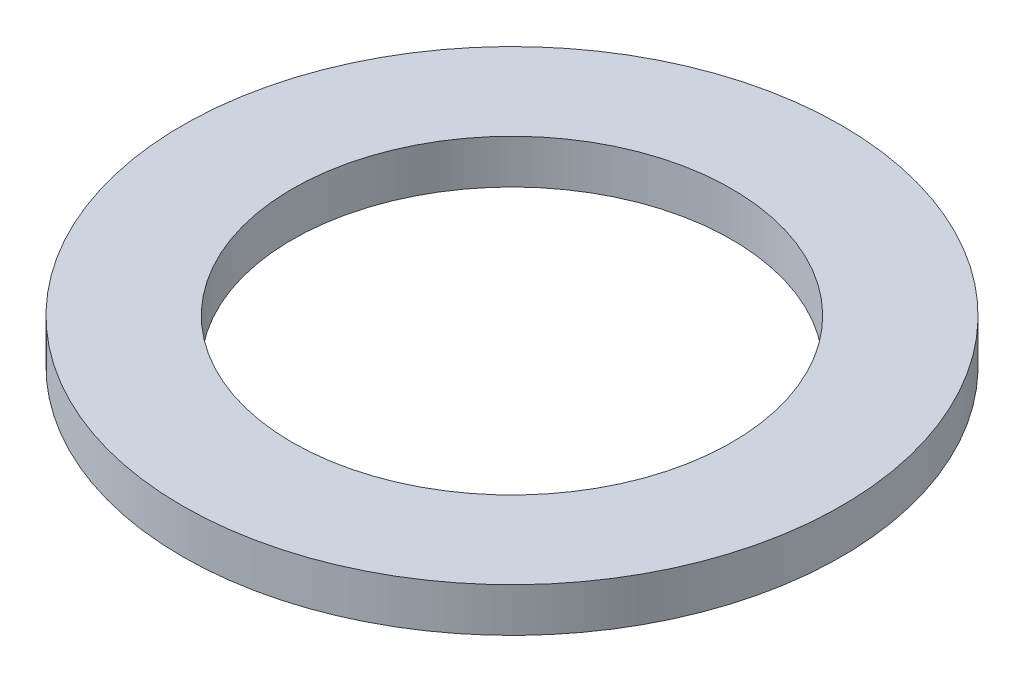
from build123d import *

# Parameters (mm, degrees)
SKETCH_1_R      = 7.5
SKETCH_1_R_2    = 5
EXTRUDE_1_DEPTH = 1


with BuildPart() as part:
    # 草图1 → 凸台-拉伸1 (new body)
    with BuildSketch(Plane(origin=(0, 0, 0), x_dir=(1, 0, 0), z_dir=(0, 1, 0))):
        with Locations(Location((0, 0, 0), (0, 0, 270))):
            Circle(SKETCH_1_R)
        with Locations(Location((0, 0, 0), (0, 0, 270))):
            Circle(SKETCH_1_R_2, mode=Mode.SUBTRACT)
    extrude(amount=EXTRUDE_1_DEPTH)


solid = part.part
